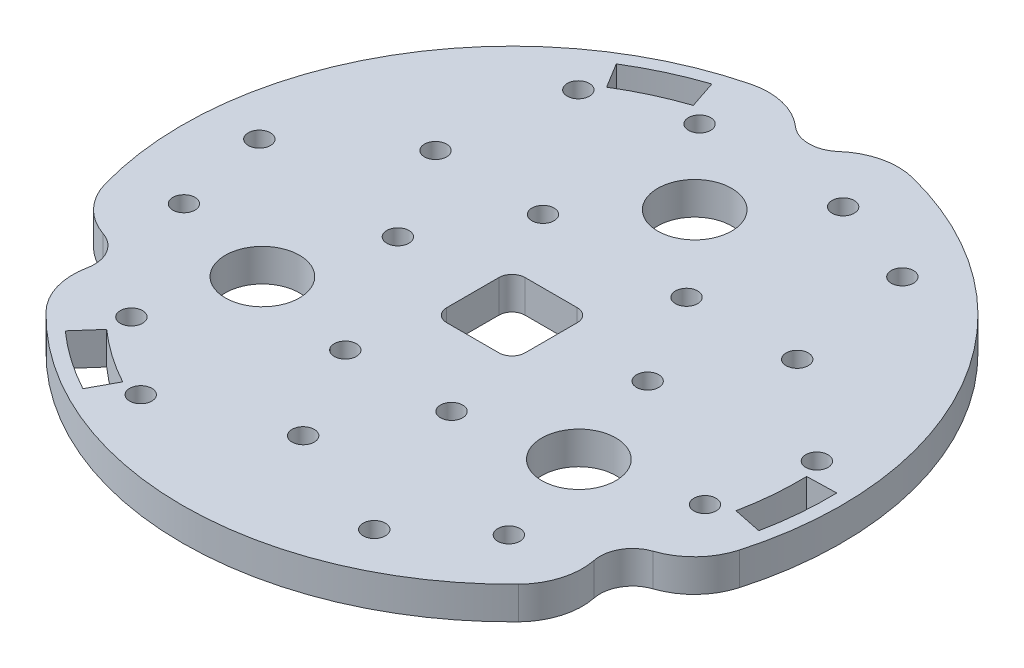
from build123d import *

# Parameters (mm, degrees)
SKETCH1_R                = 50.5
SKETCH1_R_2              = 5.675
BOSS_EXTRUDE1_DEPTH      = 5
SKETCH4_R                = 1.7
CUT_EXTRUDE5_DEPTH       = 72.592597383
SKETCH8_R                = 1.7
CUT_EXTRUDE9_DEPTH       = 72.592597383
SKETCH9_R                = 1.7
CUT_EXTRUDE10_DEPTH      = 72.592597383
CIRPATTERN3_COUNT        = 3
CUT_EXTRUDE11_DEPTH      = 72.592597383
CIRPATTERN4_COUNT        = 3
SKETCH11_W               = 12
SKETCH11_H               = 12
CUT_EXTRUDE12_DEPTH      = 72.592597383
FILLET1_R                = 2
CUT_EXTRUDE13_DEPTH      = 72.592597383
FILLET2_R                = 10
CIRPATTERN5_COUNT        = 3
FILLET2_OF_CIRPATTERN5_R = 10


with BuildPart() as part:
    # Sketch1 → Boss-Extrude1 (new body)
    with BuildSketch(Plane(origin=(0, 0, 0), x_dir=(1, 0, 0), z_dir=(0, 1, 0))):
        with Locations(Location((0, 0, 0), (0, 0, 270))):
            Circle(SKETCH1_R)
        with Locations(Location((0, 28, 0), (0, 0, 270))):
            Circle(SKETCH1_R_2, mode=Mode.SUBTRACT)
        with Locations(Location((24.248711306, -14, 0), (0, 0, 270))):
            Circle(SKETCH1_R_2, mode=Mode.SUBTRACT)
        with Locations(Location((-24.248711306, -14, 0), (0, 0, 270))):
            Circle(SKETCH1_R_2, mode=Mode.SUBTRACT)
    extrude(amount=BOSS_EXTRUDE1_DEPTH)

    # Sketch4 → Cut-Extrude5 (cut, through all)
    with BuildSketch(Plane(origin=(0, 0, 0), x_dir=(1, 0, 0), z_dir=(0, 1, 0))):
        with Locations(Location((27.712812921, 16, 0), (0, 0, 270))):
            Circle(SKETCH4_R)
        with Locations(Location((0, -32, 0), (0, 0, 270))):
            Circle(SKETCH4_R)
        with Locations(Location((-27.712812921, 16, 0), (0, 0, 270))):
            Circle(SKETCH4_R)
    extrude(amount=CUT_EXTRUDE5_DEPTH, mode=Mode.SUBTRACT)

    # Sketch8 → Cut-Extrude9 (cut, through all)
    with BuildSketch(Plane(origin=(0, 5, 0), x_dir=(1, 0, 0), z_dir=(0, 1, 0))):
        with Locations(Location((11, 39.75, 0), (0, 0, 270))):
            Circle(SKETCH8_R)
        with Locations(Location((11, 15.75, 0), (0, 0, 270))):
            Circle(SKETCH8_R)
        with Locations(Location((-11, 39.75, 0), (0, 0, 90))):
            Circle(SKETCH8_R)
        with Locations(Location((-11, 15.75, 0), (0, 0, 90))):
            Circle(SKETCH8_R)
    cut_extrude9 = extrude(amount=-CUT_EXTRUDE9_DEPTH, mode=Mode.SUBTRACT)

    # Sketch9 → Cut-Extrude10 (cut, through all)
    with BuildSketch(Plane.XZ):
        with Locations(Location((-17.892304845, 39, 0), (0, 0, 270))):
            Circle(SKETCH9_R)
        with Locations(Location((17.892304845, 39, 0), (0, 0, 90))):
            Circle(SKETCH9_R)
    cut_extrude10 = extrude(amount=-CUT_EXTRUDE10_DEPTH, mode=Mode.SUBTRACT)

    # CirPattern3: Cut-Extrude9, Cut-Extrude10 ×3 about axis
    cirpattern3_axis = Axis((0, 0, 0), (0, 1, 0))
    add([cut_extrude9.rotate(cirpattern3_axis, i * 360 / CIRPATTERN3_COUNT) for i in range(1, CIRPATTERN3_COUNT)], mode=Mode.SUBTRACT)
    add([cut_extrude10.rotate(cirpattern3_axis, i * 360 / CIRPATTERN3_COUNT) for i in range(1, CIRPATTERN3_COUNT)], mode=Mode.SUBTRACT)

    # Sketch10 → Cut-Extrude11 (cut, through all)
    with BuildSketch(Plane(origin=(0, 5, 0), x_dir=(1, 0, 0), z_dir=(0, 1, 0))):
        with BuildLine():
            Line((-13.943212455, 41.732323521), (-15.36922282, 46.000402062))
            ThreePointArc((-15.36922282, 46.000402062), (-20.496985694, 43.955927671), (-25.359206382, 41.341996223))
            Line((-25.359206382, 41.341996223), (-23.006290326, 37.506140903))
            ThreePointArc((-23.006290326, 37.506140903), (-18.595203517, 39.87754263), (-13.943212455, 41.732323521))
        make_face()
    cut_extrude11 = extrude(amount=-CUT_EXTRUDE11_DEPTH, mode=Mode.SUBTRACT)

    # CirPattern4: Cut-Extrude11 ×3 about axis
    cirpattern4_axis = Axis((0, 0, 0), (0, 1, 0))
    for i in range(1, CIRPATTERN4_COUNT):
        add(cut_extrude11.rotate(cirpattern4_axis, i * 360 / CIRPATTERN4_COUNT), mode=Mode.SUBTRACT)

    # Sketch11 → Cut-Extrude12 (cut, through all)
    with BuildSketch(Plane(origin=(0, 5, 0), x_dir=(1, 0, 0), z_dir=(0, 1, 0))):
        Rectangle(SKETCH11_W, SKETCH11_H)
    extrude(amount=-CUT_EXTRUDE12_DEPTH, mode=Mode.SUBTRACT)

    # Fillet1
    fillet1_edges = [part.edges().sort_by_distance(p)[0] for p in [
        (6, 2.5, -6),
        (6, 2.5, 6),
        (-6, 2.5, 6),
        (-6, 2.5, -6),
    ]]
    fillet(fillet1_edges, radius=FILLET1_R)

    # Sketch12 → Cut-Extrude13 (cut, through all)
    with BuildSketch(Plane(origin=(0, 5, 0), x_dir=(1, 0, 0), z_dir=(0, 1, 0))):
        with BuildLine():
            ThreePointArc((46.016854863, -20.801419868), (39.404155872, -22.75), (41.022985472, -29.45105538))
            ThreePointArc((41.022985472, -29.45105538), (43.734282891, -25.25), (46.016854863, -20.801419868))
        make_face()
    cut_extrude13 = extrude(amount=-CUT_EXTRUDE13_DEPTH, mode=Mode.SUBTRACT)

    # Fillet2
    fillet2_edges = [part.edges().sort_by_distance(p)[0] for p in [
        (46.016854863, 2.5, 20.801419868),
        (41.022985472, 2.5, 29.45105538),
    ]]
    fillet(fillet2_edges, radius=FILLET2_R)

    # CirPattern5: Cut-Extrude13 ×3 about axis
    cirpattern5_axis = Axis((0, 0, 0), (0, 1, 0))
    for i in range(1, CIRPATTERN5_COUNT):
        add(cut_extrude13.rotate(cirpattern5_axis, i * 360 / CIRPATTERN5_COUNT), mode=Mode.SUBTRACT)

    # Fillet2 of CirPattern5
    fillet2_of_cirpattern5_edges = [part.edges().sort_by_distance(p)[0] for p in [
        (-4.993869391, 2.5, -50.252475248),
        (4.993869391, 2.5, -50.252475248),
        (-41.022985472, 2.5, 29.45105538),
        (-46.016854863, 2.5, 20.801419868),
    ]]
    fillet(fillet2_of_cirpattern5_edges, radius=FILLET2_OF_CIRPATTERN5_R)


solid = part.part
